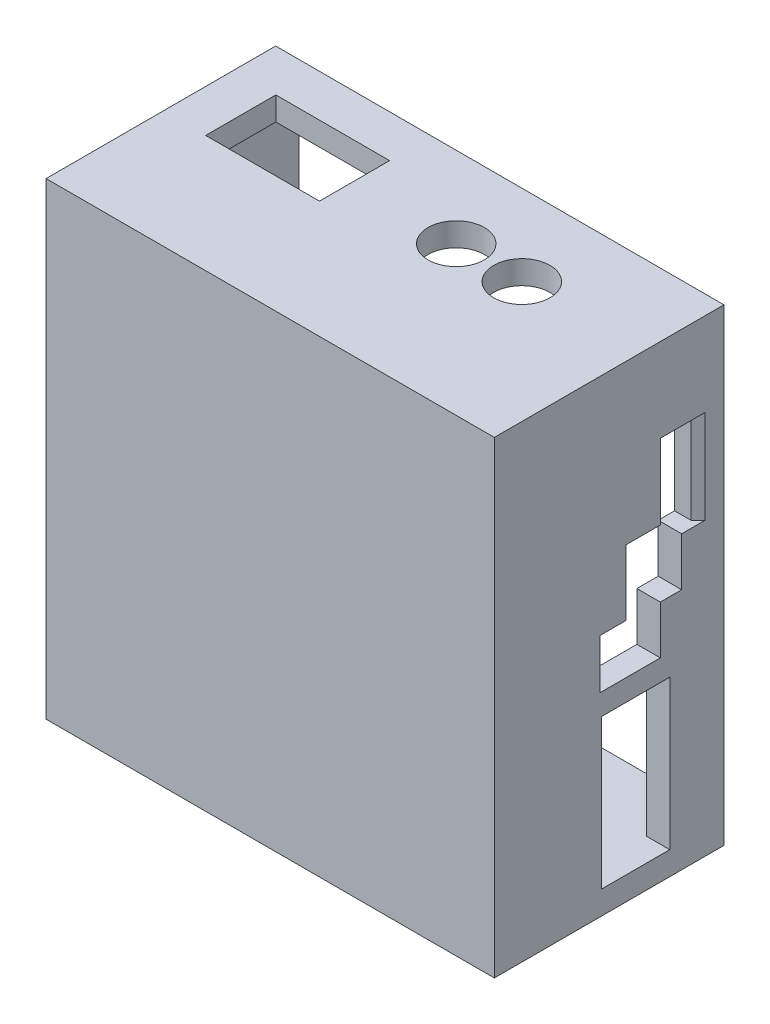
from build123d import *

# Parameters (mm, degrees)
SCHIZZO2_W                = 95.661065857
SCHIZZO2_H                = 99.914617901
SCHIZZO2_W_2              = 85.661065857
SCHIZZO2_H_2              = 89.914617901
ESTRUSIONE_SOTTILE1_DEPTH = 45
SCHIZZO5_W                = 14.572404991
SCHIZZO5_H                = 31.877712984
TAGLIO_ESTRUSIONE2_DEPTH  = 5
SCHIZZO6_W                = 17.563316518
SCHIZZO6_H                = 14.837974299
SCHIZZO6_W_2              = 14.53926904
SCHIZZO6_H_2              = 16.284185158
SCHIZZO6_W_3              = 14.178791295
TAGLIO_ESTRUSIONE3_DEPTH  = 5
SMUSSO5_SIZE              = 2
SMUSSO6_SIZE              = 1.5
SKETCH1_R                 = 6
SKETCH1_W                 = 24.285177085
SKETCH1_H                 = 14.972609064
CUT_EXTRUDE1_DEPTH        = 10
FILLET1_R                 = 2
FILLET2_R                 = 1
SKETCH2_W                 = 95.661065857
SKETCH2_H                 = 99.914617901
BOSS_EXTRUDE1_DEPTH       = 4


with BuildPart() as part:
    # Schizzo2 → Estrusione-Sottile1 (new body)
    with BuildSketch(Plane.XY.offset(6.703232706)):
        with Locations((-1.032219499, 3.65730895)):
            Rectangle(SCHIZZO2_W, SCHIZZO2_H)
        with Locations((-1.032219499, 3.65730895)):
            Rectangle(SCHIZZO2_W_2, SCHIZZO2_H_2, mode=Mode.SUBTRACT)
    extrude(amount=-ESTRUSIONE_SOTTILE1_DEPTH)

    # Schizzo5 → Taglio-Estrusione2 (cut)
    with BuildSketch(Plane(origin=(46.798313429, 0, 0), x_dir=(0, 0, -1), z_dir=(1, 0, 0))):
        Polygon((32.751075083, 35.734689364), (24.713552886, 35.734689364), (24.713552886, 19.705476421), (17.402976387, 19.705476421), (17.402976387, 5.715425641), (11.875438841, 5.715425641), (11.875438841, 5.226263026), (11.875438841, -4.850486837), (24.713552886, -4.850486837), (24.713552886, 5.470844333), (29.271954363, 5.470844333), (29.271954363, 15.813468704), (32.751075083, 15.813468704), align=None)
        with Locations((19.448395228, -25.361143508)):
            Rectangle(SCHIZZO5_W, SCHIZZO5_H)
    extrude(amount=-TAGLIO_ESTRUSIONE2_DEPTH, mode=Mode.SUBTRACT)

    # Schizzo6 → Taglio-Estrusione3 (cut)
    with BuildSketch(Plane.XZ.offset(46.3)):
        with Locations((18.323185023, -16.793891295)):
            Rectangle(SCHIZZO6_W, SCHIZZO6_H)
        with Locations((-6.016266439, -16.070785866)):
            Rectangle(SCHIZZO6_W_2, SCHIZZO6_H_2)
        with Locations((-28.245727369, -16.070785866)):
            Rectangle(SCHIZZO6_W_3, SCHIZZO6_H_2)
    extrude(amount=-TAGLIO_ESTRUSIONE3_DEPTH, mode=Mode.SUBTRACT)

    # Smusso5
    smusso5_edges = [part.edges().sort_by_distance(p)[0] for p in [
        (-21.156331721, -46.3, -16.070785866),
        (-28.245727368, -46.3, -24.212878445),
        (-35.335123016, -46.3, -16.070785866),
        (-28.245727368, -46.3, -7.928693287),
    ]]
    chamfer(smusso5_edges, length=SMUSSO5_SIZE)

    # Smusso6
    smusso6_edges = [part.edges().sort_by_distance(p)[0] for p in [
        (46.798313429, 25.774079034, -32.751075083),
    ]]
    chamfer(smusso6_edges, length=SMUSSO6_SIZE)

    # Sketch1 → Cut-Extrude1 (cut)
    with BuildSketch(Plane(origin=(0, 53.614617901, 0), x_dir=(1, 0, 0), z_dir=(0, 1, 0))):
        with Locations((20.937247572, 21.021954363)):
            Circle(SKETCH1_R)
        with Locations((6.937247572, 21.021954363)):
            Circle(SKETCH1_R)
        with Locations((-27.662752428, 21.785649831)):
            Rectangle(SKETCH1_W, SKETCH1_H)
    extrude(amount=-CUT_EXTRUDE1_DEPTH, mode=Mode.SUBTRACT)

    # Fillet1
    fillet1_edges = [part.edges().sort_by_distance(p)[0] for p in [
        (-6.016266439, -46.3, -24.212878445),
        (1.253368081, -46.3, -16.070785866),
        (-6.016266439, -46.3, -7.928693287),
        (-13.285900959, -46.3, -16.070785866),
    ]]
    fillet(fillet1_edges, radius=FILLET1_R)

    # Fillet2
    fillet2_edges = [part.edges().sort_by_distance(p)[0] for p in [
        (27.104843282, -46.3, -16.793891295),
        (18.323185023, -46.3, -9.374904146),
        (9.541526764, -46.3, -16.793891295),
        (18.323185023, -46.3, -24.212878445),
    ]]
    fillet(fillet2_edges, radius=FILLET2_R)

    # Sketch2 → Boss-Extrude1 (add)
    with BuildSketch(Plane.XY.offset(6.703232706)):
        with Locations((-1.032219499, 3.65730895)):
            Rectangle(SKETCH2_W, SKETCH2_H)
    extrude(amount=BOSS_EXTRUDE1_DEPTH)


solid = part.part
